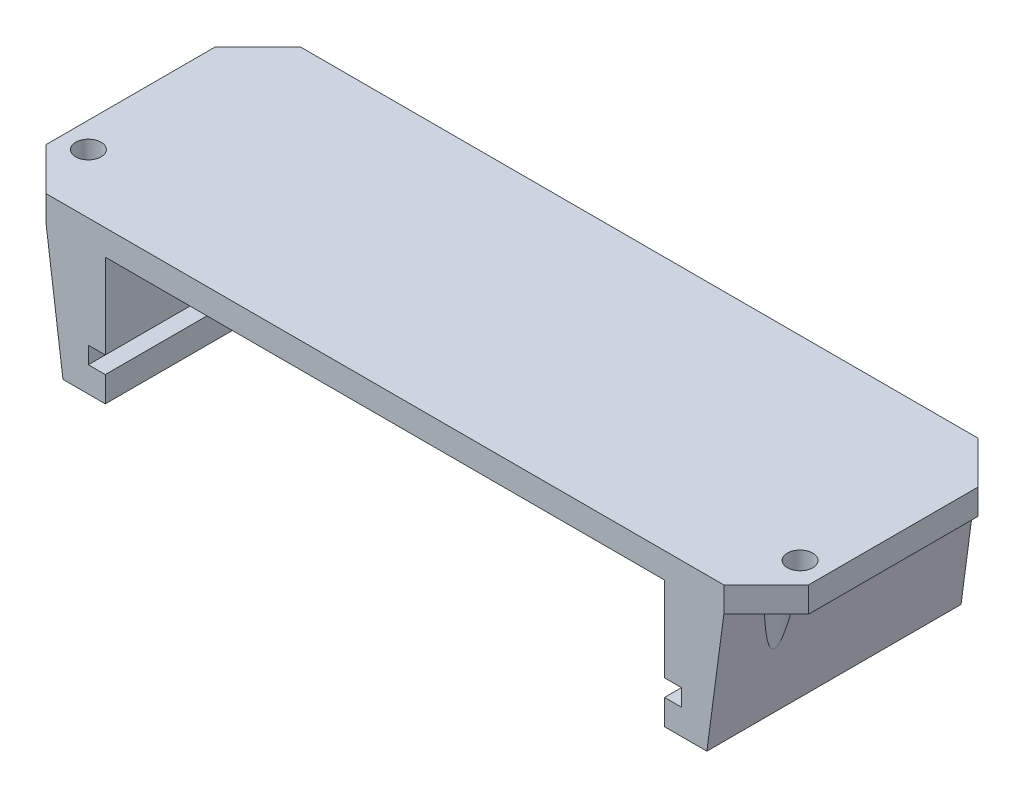
from build123d import *

# Parameters (mm, degrees)
BOSS_EXTRUDE1_DEPTH = 30
SKETCH2_R           = 1.5
CUT_EXTRUDE1_DEPTH  = 20
CUT_EXTRUDE2_START  = 20
SKETCH2_3_R         = 3
SKETCH2_3_R_2       = 1.5
CUT_EXTRUDE2_DEPTH  = 20
CHAMFER1_SIZE       = 5


with BuildPart() as part:
    # Sketch1 → Boss-Extrude1 (new body)
    with BuildSketch(Plane(origin=(0, 0, 0), x_dir=(1, 0, 0), z_dir=(0, 0, -1))):
        Polygon((-3, 11.892818554), (-5, -3.107181446), (-10, -3.107181446), (-10, -6.107181446), (80, -6.107181446), (80, -3.107181446), (75, -3.107181446), (73, 11.892818554), (68, 11.892818554), (68, 8.892818554), (70, 8.892818554), (70, 6.892818554), (68, 6.892818554), (68, -3.107181446), (2, -3.107181446), (2, 6.892818554), (0, 6.892818554), (0, 8.892818554), (2, 8.892818554), (2, 11.892818554), align=None)
    extrude(amount=BOSS_EXTRUDE1_DEPTH)

    # Sketch2 → Cut-Extrude1 (cut)
    with BuildSketch(Plane(origin=(0, 3.107181446, 0), x_dir=(-1, 0, 0), z_dir=(0, -1, 0))):
        with Locations((7, 7)):
            Circle(SKETCH2_R)
        with Locations((-77, 7)):
            Circle(SKETCH2_R)
    extrude(amount=-CUT_EXTRUDE1_DEPTH, mode=Mode.SUBTRACT)

    # Sketch2<3> → Cut-Extrude2 (cut)
    # profile 1 of 2: a face of its own
    with BuildSketch(Plane(origin=(0, 3.107181446, 0), x_dir=(-1, 0, 0), z_dir=(0, -1, 0)).offset(CUT_EXTRUDE2_START)):
        with Locations((7, 7)):
            Circle(SKETCH2_3_R)
        with Locations((7, 7)):
            Circle(SKETCH2_3_R_2, mode=Mode.SUBTRACT)
    # profile 2 of 2: a face of its own
    with BuildSketch(Plane(origin=(0, 3.107181446, 0), x_dir=(-1, 0, 0), z_dir=(0, -1, 0)).offset(CUT_EXTRUDE2_START)):
        with Locations((-77, 7)):
            Circle(SKETCH2_3_R)
        with Locations((-77, 7)):
            Circle(SKETCH2_3_R_2, mode=Mode.SUBTRACT)
    extrude(amount=-CUT_EXTRUDE2_DEPTH, mode=Mode.SUBTRACT)

    # Chamfer1
    chamfer1_edges = [part.edges().sort_by_distance(p)[0] for p in [
        (80, 4.607181446, 0),
        (80, 4.607181446, -30),
        (-10, 4.607181446, 0),
        (-10, 4.607181446, -30),
    ]]
    chamfer(chamfer1_edges, length=CHAMFER1_SIZE)


solid = part.part
